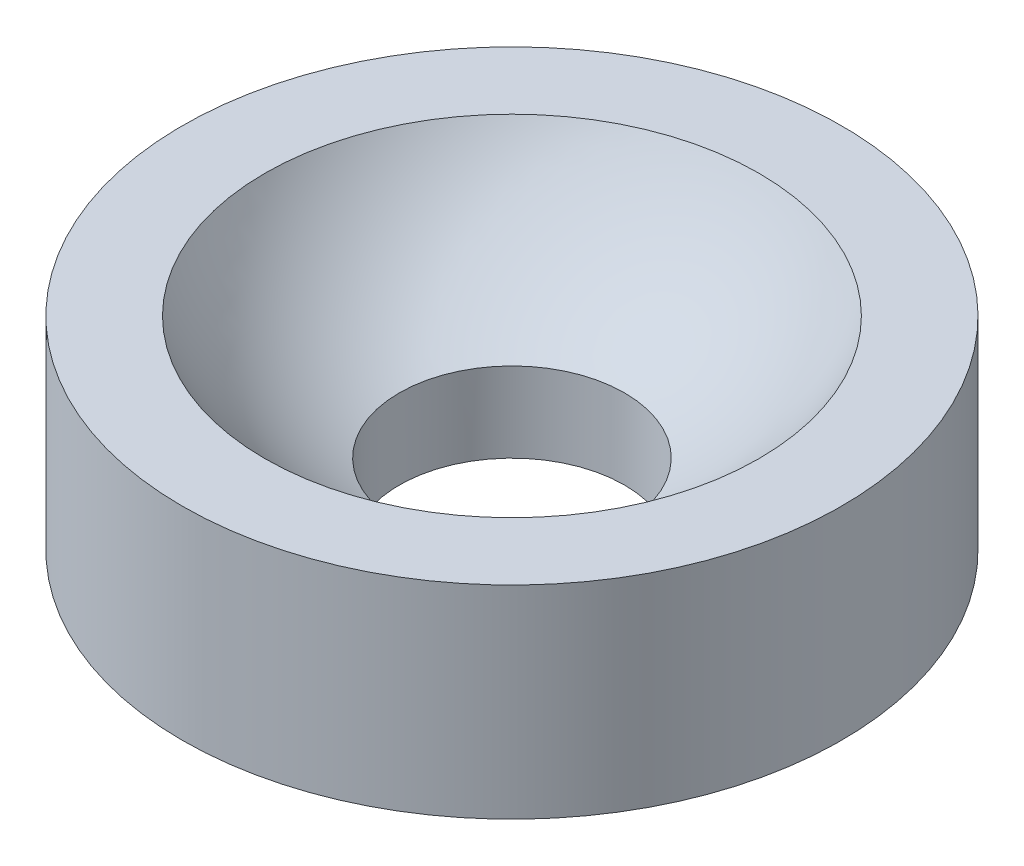
from build123d import *

# Parameters (mm, degrees)
SKETCH1_R           = 5.85
BOSS_EXTRUDE1_DEPTH = 3.6
SKETCH3_R           = 2
CUT_EXTRUDE1_DEPTH  = 4


with BuildPart() as part:
    # Sketch1 → Boss-Extrude1 (new body)
    with BuildSketch(Plane(origin=(0, 0, 0), x_dir=(1, 0, 0), z_dir=(0, 1, 0))):
        with Locations(Location((0, 0, 0), (0, 0, 270))):
            Circle(SKETCH1_R)
    extrude(amount=BOSS_EXTRUDE1_DEPTH)

    # Sketch2 → Cut-Revolve1 (revolve, cut)
    with BuildSketch(Plane.XY):
        with BuildLine():
            Line((0, 1), (0, 11))
            ThreePointArc((0, 11), (5, 6), (0, 1))
        make_face()
    revolve(axis=Axis((0, 1, 0), (0, 1, 0)), mode=Mode.SUBTRACT)

    # Sketch3 → Cut-Extrude1 (cut)
    with BuildSketch(Plane.XZ):
        with Locations(Location((0, 0, 0), (0, 0, 270))):
            Circle(SKETCH3_R)
    extrude(amount=-CUT_EXTRUDE1_DEPTH, mode=Mode.SUBTRACT)


solid = part.part
